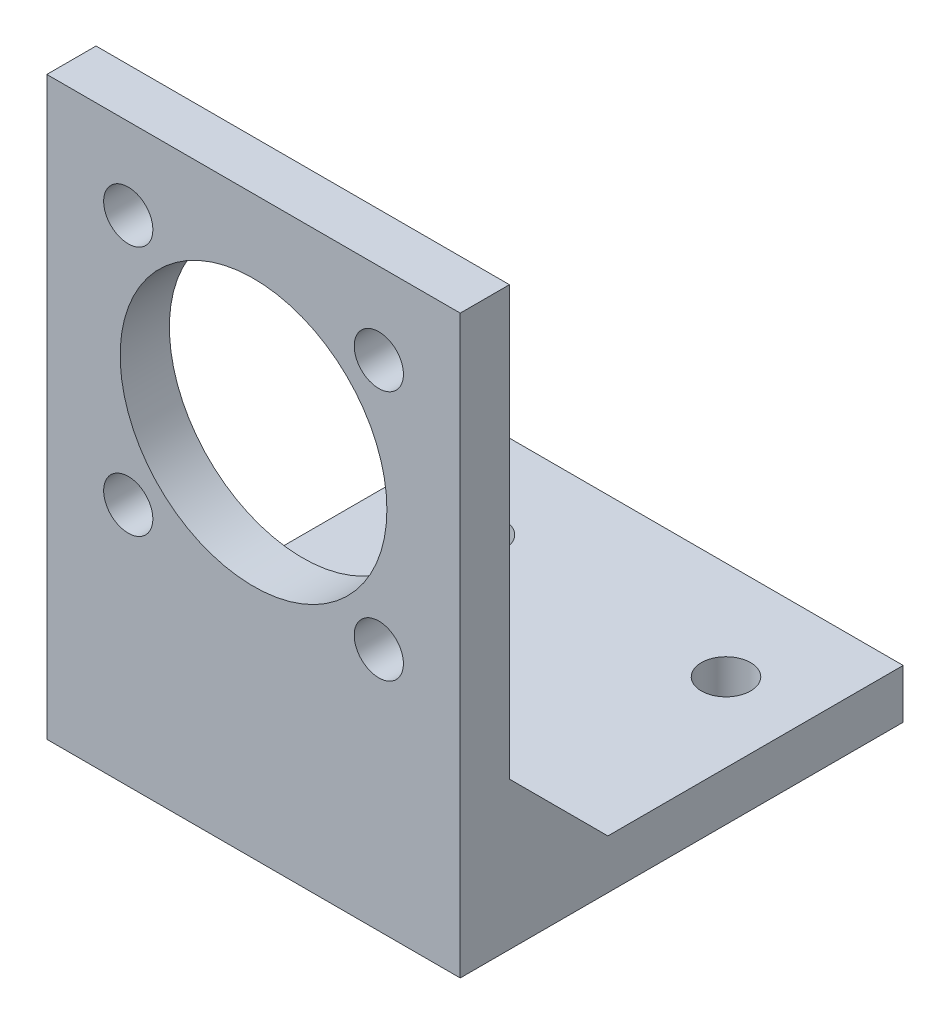
from build123d import *

# Parameters (mm, degrees)
SKETCH_1_W             = 40
SKETCH_1_H             = 42
SKETCH_1_R             = 2.5
EXTRUDE_1_DEPTH        = 5
SKETCH_2_W             = 42
SKETCH_2_H             = 58.5
SKETCH_2_R             = 13.55
SKETCH_2_R_2           = 2.5
EXTRUDE_2_DEPTH        = 5
EXTRUDE_3_DEPTH        = 5
PATTERN_LINEAR_1_COUNT = 2
PATTERN_LINEAR_1_PITCH = 37


with BuildPart() as part:
    # 草图1 → 凸台-拉伸1 (new body)
    with BuildSketch(Plane(origin=(0, 0, 0), x_dir=(0, 0, -1), z_dir=(0, 1, 0))):
        with Locations((-20, 21)):
            Rectangle(SKETCH_1_W, SKETCH_1_H)
        with Locations(Location((-10, 33, 0), (0, 0, 180))):
            Circle(SKETCH_1_R, mode=Mode.SUBTRACT)
        with Locations(Location((-10, 8, 0), (0, 0, 180))):
            Circle(SKETCH_1_R, mode=Mode.SUBTRACT)
    extrude(amount=EXTRUDE_1_DEPTH)

    # 草图2 → 凸台-拉伸2 (add)
    with BuildSketch(Plane.XY.offset(40)):
        with Locations((-21, 29.25)):
            Rectangle(SKETCH_2_W, SKETCH_2_H)
        with Locations((-21, 37.5)):
            Circle(SKETCH_2_R, mode=Mode.SUBTRACT)
        with Locations((-33.727922061, 24.772077939)):
            Circle(SKETCH_2_R_2, mode=Mode.SUBTRACT)
        with Locations((-8.272077939, 50.227922061)):
            Circle(SKETCH_2_R_2, mode=Mode.SUBTRACT)
        with Locations((-33.727922061, 50.227922061)):
            Circle(SKETCH_2_R_2, mode=Mode.SUBTRACT)
        with Locations((-8.272077939, 24.772077939)):
            Circle(SKETCH_2_R_2, mode=Mode.SUBTRACT)
    extrude(amount=EXTRUDE_2_DEPTH)

    # 草图3 → 凸台-拉伸3 (add)
    with BuildSketch(Plane(origin=(0, 0, 0), x_dir=(0, 0, -1), z_dir=(1, 0, 0))):
        Polygon((-40, 15), (-40, 5), (-30, 5), align=None)
    extrude_3 = extrude(amount=-EXTRUDE_3_DEPTH)

    # 阵列(线性)1: 凸台-拉伸3 ×2
    with Locations(*[(-i * PATTERN_LINEAR_1_PITCH, 0, 0) for i in range(1, PATTERN_LINEAR_1_COUNT)]):
        add(extrude_3)


solid = part.part
